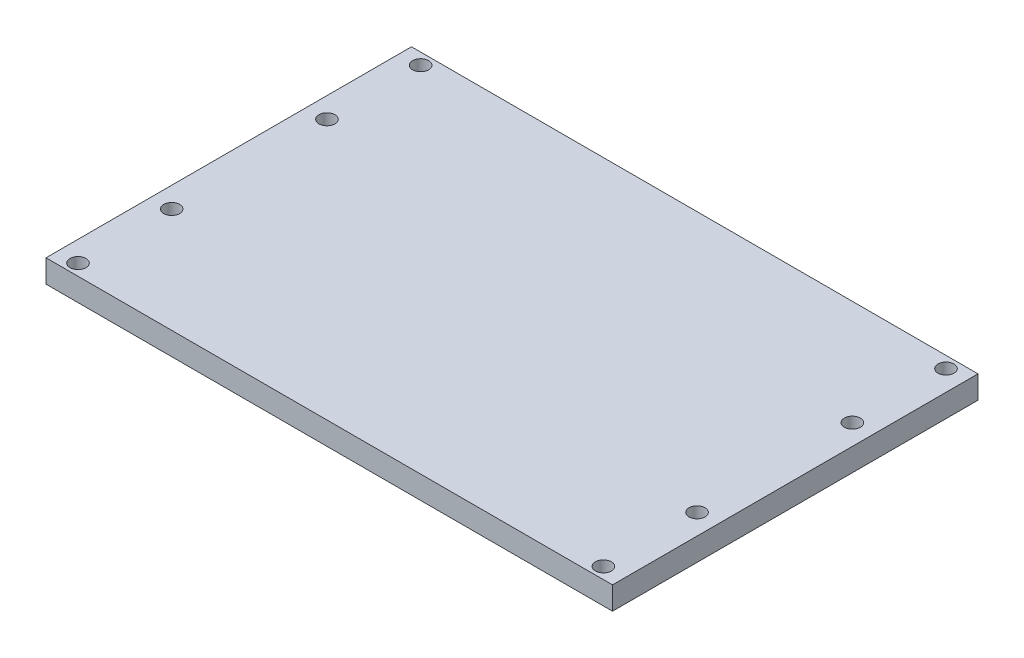
from build123d import *

# Parameters (mm, degrees)
SKETCH_1_W          = 124
SKETCH_1_H          = 80
EXTRUDE_1_DEPTH     = 5
SKETCH_2_R          = 1.15
CUT_EXTRUDE_1_DEPTH = 74.952687578
SKETCH_2_3_R        = 1.75
CUT_EXTRUDE_2_DEPTH = 3


with BuildPart() as part:
    # 草图1 → 凸台-拉伸1 (new body)
    with BuildSketch(Plane(origin=(0, 0, 0), x_dir=(1, 0, 0), z_dir=(0, 1, 0))):
        Rectangle(SKETCH_1_W, SKETCH_1_H)
    extrude(amount=EXTRUDE_1_DEPTH)

    # 草图2 → 切除-拉伸1 (cut, through all)
    with BuildSketch(Plane(origin=(0, 5, 0), x_dir=(1, 0, 0), z_dir=(0, 1, 0))):
        with Locations((-57.5, 37.5)):
            Circle(SKETCH_2_R)
        with Locations((-57.5, 17)):
            Circle(SKETCH_2_R)
        with Locations((-57.5, -17)):
            Circle(SKETCH_2_R)
        with Locations((-57.5, -37.5)):
            Circle(SKETCH_2_R)
        with Locations((57.5, 37.5)):
            Circle(SKETCH_2_R)
        with Locations((57.5, 17)):
            Circle(SKETCH_2_R)
        with Locations((57.5, -17)):
            Circle(SKETCH_2_R)
        with Locations((57.5, -37.5)):
            Circle(SKETCH_2_R)
    extrude(amount=-CUT_EXTRUDE_1_DEPTH, mode=Mode.SUBTRACT)

    # 草图2<3> → 切除-拉伸2 (cut)
    with BuildSketch(Plane(origin=(0, 5, 0), x_dir=(1, 0, 0), z_dir=(0, 1, 0))):
        with Locations((-57.5, 37.5)):
            Circle(SKETCH_2_3_R)
        with Locations((-57.5, 17)):
            Circle(SKETCH_2_3_R)
        with Locations((-57.5, -17)):
            Circle(SKETCH_2_3_R)
        with Locations((-57.5, -37.5)):
            Circle(SKETCH_2_3_R)
        with Locations((57.5, 37.5)):
            Circle(SKETCH_2_3_R)
        with Locations((57.5, 17)):
            Circle(SKETCH_2_3_R)
        with Locations((57.5, -17)):
            Circle(SKETCH_2_3_R)
        with Locations((57.5, -37.5)):
            Circle(SKETCH_2_3_R)
    extrude(amount=-CUT_EXTRUDE_2_DEPTH, mode=Mode.SUBTRACT)


solid = part.part
